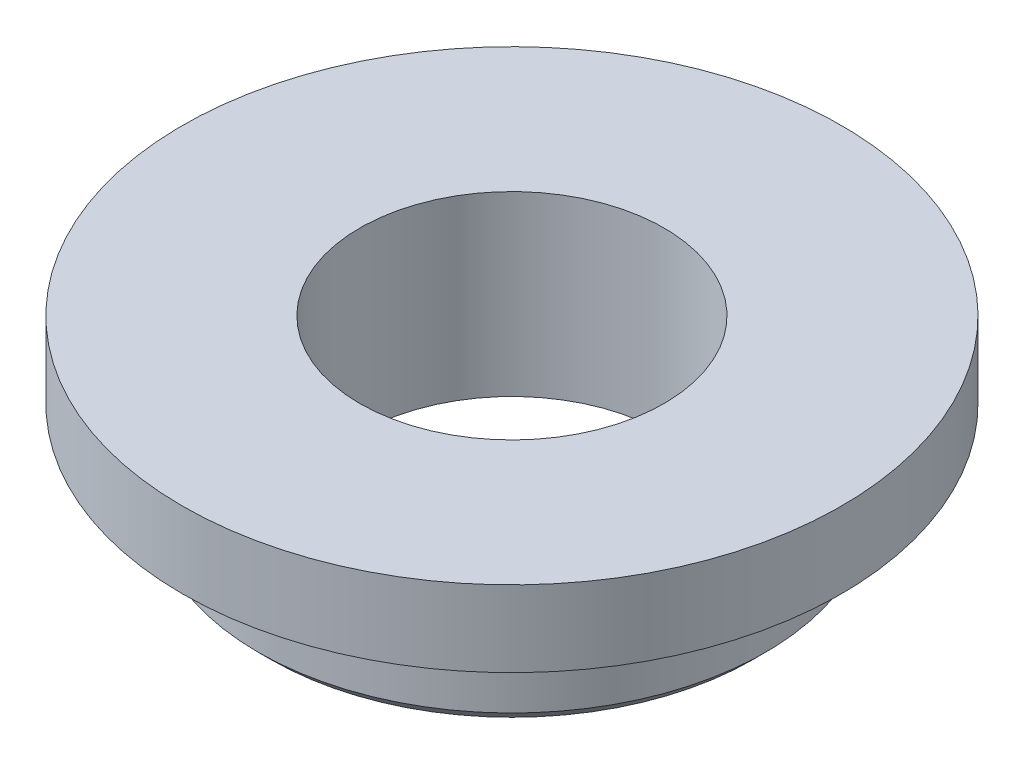
from build123d import *

# Parameters (mm, degrees)
SKETCH1_R           = 13
BOSS_EXTRUDE1_DEPTH = 3
SKETCH2_R           = 10
BOSS_EXTRUDE2_DEPTH = 4
CHAMFER1_SIZE       = 0.5
SKETCH3_R           = 6
CUT_EXTRUDE1_DEPTH  = 20.672315573


with BuildPart() as part:
    # Sketch1 → Boss-Extrude1 (new body)
    with BuildSketch(Plane(origin=(0, 0, 0), x_dir=(1, 0, 0), z_dir=(0, 1, 0))):
        with Locations(Location((0, 0, 0), (0, 0, 270))):
            Circle(SKETCH1_R)
    extrude(amount=BOSS_EXTRUDE1_DEPTH)

    # Sketch2 → Boss-Extrude2 (add)
    with BuildSketch(Plane.XZ):
        with Locations(Location((0, 0, 0), (0, 0, 270))):
            Circle(SKETCH2_R)
    extrude(amount=BOSS_EXTRUDE2_DEPTH)

    # Chamfer1
    chamfer1_edges = [part.edges().sort_by_distance(p)[0] for p in [
        (0, 0, 10),
        (0, -4, 10),
    ]]
    chamfer(chamfer1_edges, length=CHAMFER1_SIZE)

    # Sketch3 → Cut-Extrude1 (cut, through all)
    with BuildSketch(Plane(origin=(0, 3, 0), x_dir=(1, 0, 0), z_dir=(0, 1, 0))):
        with Locations(Location((0, 0, 0), (0, 0, 270))):
            Circle(SKETCH3_R)
    extrude(amount=-CUT_EXTRUDE1_DEPTH, mode=Mode.SUBTRACT)


solid = part.part
